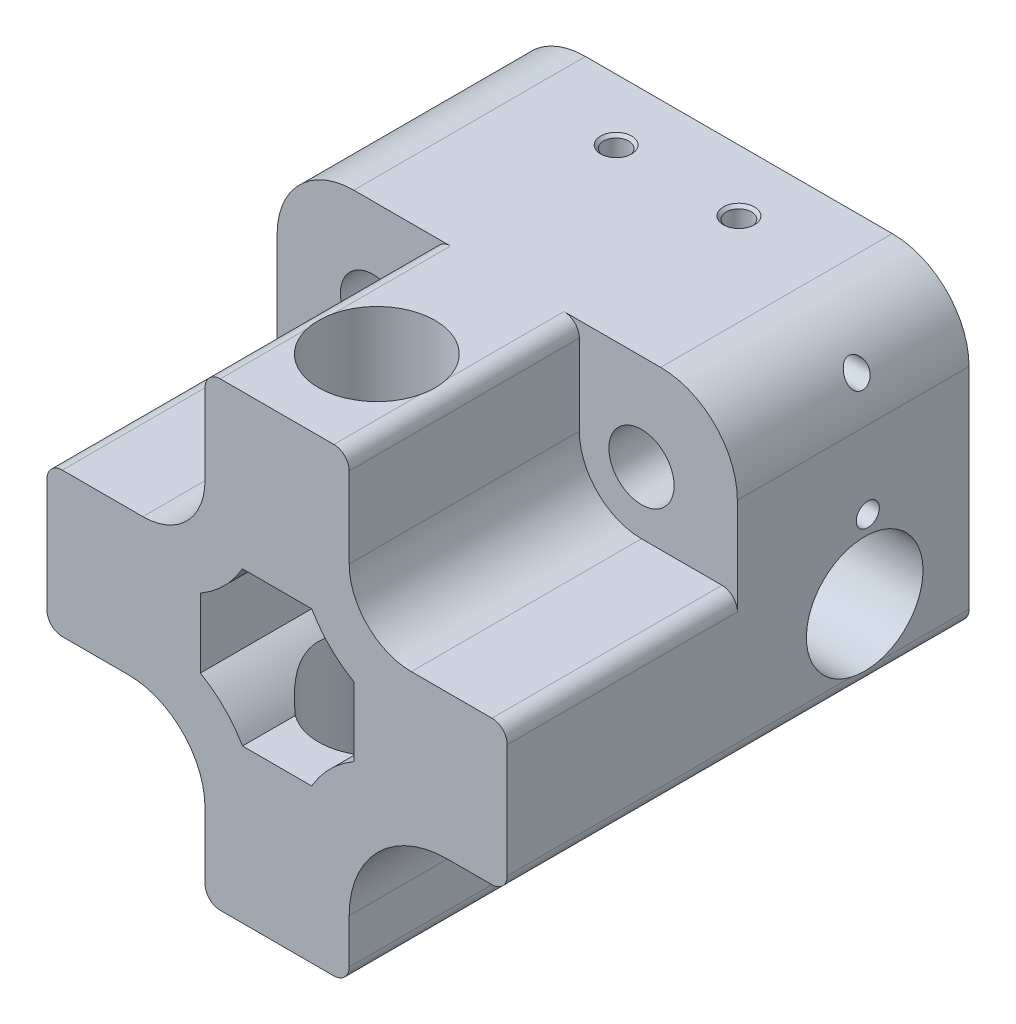
from build123d import *

# Parameters (mm, degrees)
SCHIZZO1_W                          = 60
SCHIZZO1_H                          = 60
ESTRUSIONE_ESTRUSIONE1_DEPTH        = 60.2
SCHIZZO2_R                          = 7.6
TAGLIO_ESTRUSIONE1_DEPTH            = 105.038646666
SCHIZZO3_R                          = 7.6
TAGLIO_ESTRUSIONE2_DEPTH            = 105.038646666
SCHIZZO4_R                          = 8.1
TAGLIO_ESTRUSIONE3_DEPTH            = 105.038646666
TAGLIO_ESTRUSIONE4_DEPTH            = 105.038646666
RACCORDO1_R                         = 10
TAGLIO_ESTRUSIONE5_DEPTH            = 30
SCHIZZO10_R                         = 8.1
ESTRUSIONE_ESTRUSIONE3_DEPTH        = 10
SCHIZZO13_R                         = 4.25
TAGLIO_ESTRUSIONE6_DEPTH            = 9.8
TAGLIO_ESTRUSIONE7_DEPTH            = 30
TAGLIO_ESTRUSIONE7_DEPTH_BACK       = 30.2
ESTRUSIONE_ESTRUSIONE4_DEPTH        = 60.2
FORO_2_6_2_6_2_D                    = 2.6
FORO_2_6_2_6_2_DEPTH                = 10
FORO_2_6_2_6_2_TIP                  = 0.781118805
SCHIZZO20_R                         = 1.5
TAGLIO_ESTRUSIONE8_DEPTH            = 71
SCHIZZO22_R                         = 1.5
TAGLIO_ESTRUSIONE9_DEPTH            = 71
FORO_FILETTATO_M4X0_7_1_D           = 3.3
FORO_FILETTATO_M4X0_7_1_DEPTH       = 11.5
FORO_FILETTATO_M4X0_7_1_CSINK_D     = 4.05
FORO_FILETTATO_M4X0_7_1_CSINK_ANGLE = 90
FORO_FILETTATO_M4X0_7_1_TIP         = 0.991420021


with BuildPart() as part:
    # Schizzo1 → Estrusione-Estrusione1 (new body)
    with BuildSketch(Plane.XY):
        with Locations((-30, 30)):
            Rectangle(SCHIZZO1_W, SCHIZZO1_H)
    extrude(amount=ESTRUSIONE_ESTRUSIONE1_DEPTH)

    # Schizzo2 → Taglio-Estrusione1 (cut, through all)
    with BuildSketch(Plane(origin=(0, 0, 0), x_dir=(0, 0, -1), z_dir=(1, 0, 0))):
        with Locations((-13.6, 30)):
            Circle(SCHIZZO2_R)
    extrude(amount=-TAGLIO_ESTRUSIONE1_DEPTH, mode=Mode.SUBTRACT)

    # Schizzo3 → Taglio-Estrusione2 (cut, through all)
    with BuildSketch(Plane(origin=(0, 60, 0), x_dir=(0, 0, -1), z_dir=(0, 1, 0))):
        with Locations(Location((-47.2, 30, 0), (0, 0, 180))):
            Circle(SCHIZZO3_R)
    extrude(amount=-TAGLIO_ESTRUSIONE2_DEPTH, mode=Mode.SUBTRACT)

    # Schizzo4 → Taglio-Estrusione3 (cut, through all)
    with BuildSketch(Plane.XY.offset(60.2)):
        with Locations((-12.5, 12.5)):
            Circle(SCHIZZO4_R)
        with Locations((-47.5, 12.5)):
            Circle(SCHIZZO4_R)
        with Locations((-47.5, 47.5)):
            Circle(SCHIZZO4_R)
        with Locations((-12.5, 47.5)):
            Circle(SCHIZZO4_R)
    extrude(amount=-TAGLIO_ESTRUSIONE3_DEPTH, mode=Mode.SUBTRACT)

    # Schizzo7 → Taglio-Estrusione4 (cut, through all)
    with BuildSketch(Plane.XY.offset(60.2)):
        with BuildLine():
            Line((-20, 34.509618943), (-20, 25.490381057))
            ThreePointArc((-20, 25.490381057), (-23.106601718, 23.106601718), (-25.490381057, 20))
            Line((-25.490381057, 20), (-34.509618943, 20))
            ThreePointArc((-34.509618943, 20), (-36.893398282, 23.106601718), (-40, 25.490381057))
            Line((-40, 25.490381057), (-40, 34.509618943))
            ThreePointArc((-40, 34.509618943), (-36.893398282, 36.893398282), (-34.509618943, 40))
            Line((-34.509618943, 40), (-25.490381057, 40))
            ThreePointArc((-25.490381057, 40), (-23.106601718, 36.893398282), (-20, 34.509618943))
        make_face()
    extrude(amount=-TAGLIO_ESTRUSIONE4_DEPTH, mode=Mode.SUBTRACT)

    # Raccordo1
    raccordo1_edges = [part.edges().sort_by_distance(p)[0] for p in [
        (-60, 0, 30.1),
        (-60, 60, 30.1),
        (0, 60, 30.1),
        (0, 0, 30.1),
    ]]
    fillet(raccordo1_edges, radius=RACCORDO1_R)

    # Schizzo8 → Taglio-Estrusione5 (cut)
    with BuildSketch(Plane.XY.offset(60.2)):
        with BuildLine():
            Line((-47.5, 20.6), (-58, 20.6))
            ThreePointArc((-58, 20.6), (-59.414213562, 21.185786438), (-60, 22.6))
            Line((-60, 22.6), (-60, 10))
            ThreePointArc((-60, 10), (-57.071067812, 2.928932188), (-50, 0))
            Line((-50, 0), (-37.4, 0))
            ThreePointArc((-37.4, 0), (-38.814213562, 0.585786438), (-39.4, 2))
            Line((-39.4, 2), (-39.4, 12.5))
            ThreePointArc((-39.4, 12.5), (-41.772435072, 18.227564928), (-47.5, 20.6))
        make_face()
        with BuildLine():
            Line((-39.4, 47.5), (-39.4, 58))
            ThreePointArc((-39.4, 58), (-38.814213562, 59.414213562), (-37.4, 60))
            Line((-37.4, 60), (-50, 60))
            ThreePointArc((-50, 60), (-57.071067812, 57.071067812), (-60, 50))
            Line((-60, 50), (-60, 37.4))
            ThreePointArc((-60, 37.4), (-59.414213562, 38.814213562), (-58, 39.4))
            Line((-58, 39.4), (-47.5, 39.4))
            ThreePointArc((-47.5, 39.4), (-41.772435072, 41.772435072), (-39.4, 47.5))
        make_face()
        with BuildLine():
            Line((-12.5, 39.4), (-2, 39.4))
            ThreePointArc((-2, 39.4), (-0.585786438, 38.814213562), (0, 37.4))
            Line((0, 37.4), (0, 50))
            ThreePointArc((0, 50), (-2.928932188, 57.071067812), (-10, 60))
            Line((-10, 60), (-22.6, 60))
            ThreePointArc((-22.6, 60), (-21.185786438, 59.414213562), (-20.6, 58))
            Line((-20.6, 58), (-20.6, 47.5))
            ThreePointArc((-20.6, 47.5), (-18.227564928, 41.772435072), (-12.5, 39.4))
        make_face()
        with BuildLine():
            Line((-20.6, 12.5), (-20.6, 2))
            ThreePointArc((-20.6, 2), (-21.185786438, 0.585786438), (-22.6, 0))
            Line((-22.6, 0), (-10, 0))
            ThreePointArc((-10, 0), (-2.928932188, 2.928932188), (0, 10))
            Line((0, 10), (0, 22.6))
            ThreePointArc((0, 22.6), (-0.585786438, 21.185786438), (-2, 20.6))
            Line((-2, 20.6), (-12.5, 20.6))
            ThreePointArc((-12.5, 20.6), (-18.227564928, 18.227564928), (-20.6, 12.5))
        make_face()
    extrude(amount=-TAGLIO_ESTRUSIONE5_DEPTH, mode=Mode.SUBTRACT)

    # Schizzo10 → Estrusione-Estrusione3 (add)
    with BuildSketch(Plane.XY.offset(30.2)):
        with Locations((-47.5, 47.5)):
            Circle(SCHIZZO10_R)
        with Locations((-12.5, 47.5)):
            Circle(SCHIZZO10_R)
    extrude(amount=-ESTRUSIONE_ESTRUSIONE3_DEPTH)

    # Schizzo13 → Taglio-Estrusione6 (cut)
    with BuildSketch(Plane.XY.offset(30.2)):
        with Locations((-12.5, 47.5)):
            Circle(SCHIZZO13_R)
        with Locations((-47.5, 47.5)):
            Circle(SCHIZZO13_R)
    extrude(amount=-TAGLIO_ESTRUSIONE6_DEPTH, mode=Mode.SUBTRACT)

    # Schizzo14 → Taglio-Estrusione7 (cut, two sides: drawn at the far end of the back side and taken through both)
    with BuildSketch(Plane.XY.offset(30.2).offset(-TAGLIO_ESTRUSIONE7_DEPTH_BACK)):
        with BuildLine():
            ThreePointArc((-39.4, 12.5), (-53.227564928, 6.772435072), (-47.5, 20.6))
            Line((-47.5, 20.6), (-58, 20.6))
            ThreePointArc((-58, 20.6), (-59.414213562, 21.185786438), (-60, 22.6))
            Line((-60, 22.6), (-60, 10))
            ThreePointArc((-60, 10), (-57.071067812, 2.928932188), (-50, 0))
            Line((-50, 0), (-37.4, 0))
            ThreePointArc((-37.4, 0), (-38.814213562, 0.585786438), (-39.4, 2))
            Line((-39.4, 2), (-39.4, 12.5))
        make_face()
        with BuildLine():
            ThreePointArc((-39.4, 12.5), (-41.772435072, 18.227564928), (-47.5, 20.6))
            ThreePointArc((-47.5, 20.6), (-53.227564928, 6.772435072), (-39.4, 12.5))
        make_face()
        with BuildLine():
            ThreePointArc((-12.5, 20.6), (-18.227564928, 18.227564928), (-20.6, 12.5))
            Line((-20.6, 12.5), (-20.6, 2))
            ThreePointArc((-20.6, 2), (-21.185786438, 0.585786438), (-22.6, 0))
            Line((-22.6, 0), (-10, 0))
            ThreePointArc((-10, 0), (-2.928932188, 2.928932188), (0, 10))
            Line((0, 10), (0, 22.6))
            ThreePointArc((0, 22.6), (-0.585786438, 21.185786438), (-2, 20.6))
            Line((-2, 20.6), (-12.5, 20.6))
        make_face()
    extrude(amount=TAGLIO_ESTRUSIONE7_DEPTH + TAGLIO_ESTRUSIONE7_DEPTH_BACK, mode=Mode.SUBTRACT)

    # Schizzo15 → Estrusione-Estrusione4 (add, through all)
    with BuildSketch(Plane.XY.offset(60.2)):
        with BuildLine():
            Line((-20.6, 12.5), (-20.6, 7.8))
            ThreePointArc((-20.6, 7.8), (-16.850966799, 16.850966799), (-7.8, 20.6))
            Line((-7.8, 20.6), (-12.5, 20.6))
            ThreePointArc((-12.5, 20.6), (-18.227564928, 18.227564928), (-20.6, 12.5))
        make_face()
        with BuildLine():
            Line((-49.4, 20.6), (-47.5, 20.6))
            ThreePointArc((-47.5, 20.6), (-41.772435072, 18.227564928), (-39.4, 12.5))
            Line((-39.4, 12.5), (-39.4, 10.6))
            ThreePointArc((-39.4, 10.6), (-42.328932188, 17.671067812), (-49.4, 20.6))
        make_face()
    extrude(amount=-ESTRUSIONE_ESTRUSIONE4_DEPTH)

    # Foro Ø2.6 (2.6)-2
    with Locations(Plane(origin=(0, 0, 0), x_dir=(-1, 0, 0), z_dir=(0, 0, -1))):
        with Locations((24.1, 16.1), (16.1, 24.1), (35.9, 16.1), (43.9, 24.1)):
            Hole(FORO_2_6_2_6_2_D / 2, depth=FORO_2_6_2_6_2_DEPTH)
            with Locations((0, 0, -(FORO_2_6_2_6_2_DEPTH + FORO_2_6_2_6_2_TIP / 2))):  # 118° drill point
                Cone(0, FORO_2_6_2_6_2_D / 2, FORO_2_6_2_6_2_TIP, mode=Mode.SUBTRACT)

    # Schizzo20 → Taglio-Estrusione8 (cut)
    with BuildSketch(Plane(origin=(0, 0, 0), x_dir=(0, 0, -1), z_dir=(1, 0, 0))):
        with Locations((-13.2, 39.9)):
            Circle(SCHIZZO20_R)
    extrude(amount=-TAGLIO_ESTRUSIONE8_DEPTH, mode=Mode.SUBTRACT)

    # Schizzo22 → Taglio-Estrusione9 (cut)
    with BuildSketch(Plane(origin=(0, 0, 0), x_dir=(0, 0, -1), z_dir=(1, 0, 0))):
        with Locations((-13.2, 55.1)):
            Circle(SCHIZZO22_R)
    extrude(amount=-TAGLIO_ESTRUSIONE9_DEPTH, mode=Mode.SUBTRACT)

    # Foro filettato M4x0.7-1
    with Locations(Plane(origin=(0, 60, 0), x_dir=(1, 0, 0), z_dir=(0, 1, 0))):
        with Locations((-38, -8), (-22, -8)):
            CounterSinkHole(FORO_FILETTATO_M4X0_7_1_D / 2, FORO_FILETTATO_M4X0_7_1_CSINK_D / 2, depth=FORO_FILETTATO_M4X0_7_1_DEPTH, counter_sink_angle=FORO_FILETTATO_M4X0_7_1_CSINK_ANGLE)
            with Locations((0, 0, -(FORO_FILETTATO_M4X0_7_1_DEPTH + FORO_FILETTATO_M4X0_7_1_TIP / 2))):  # 118° drill point
                Cone(0, FORO_FILETTATO_M4X0_7_1_D / 2, FORO_FILETTATO_M4X0_7_1_TIP, mode=Mode.SUBTRACT)


solid = part.part
